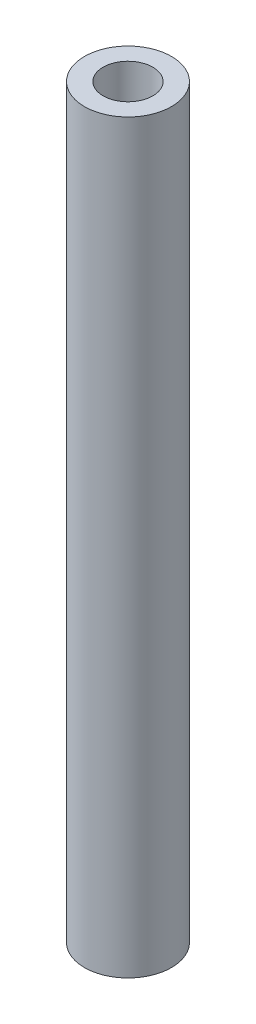
from build123d import *

# Parameters (mm, degrees)
SKETCH_1_R      = 1.75
SKETCH_1_R_2    = 1
EXTRUDE_1_DEPTH = 30


with BuildPart() as part:
    # 草图1 → 凸台-拉伸1 (new body)
    with BuildSketch(Plane(origin=(0, 0, 0), x_dir=(1, 0, 0), z_dir=(0, 1, 0))):
        with Locations(Location((0, 0, 0), (0, 0, 270))):
            Circle(SKETCH_1_R)
        with Locations(Location((0, 0, 0), (0, 0, 270))):
            Circle(SKETCH_1_R_2, mode=Mode.SUBTRACT)
    extrude(amount=EXTRUDE_1_DEPTH)


solid = part.part
